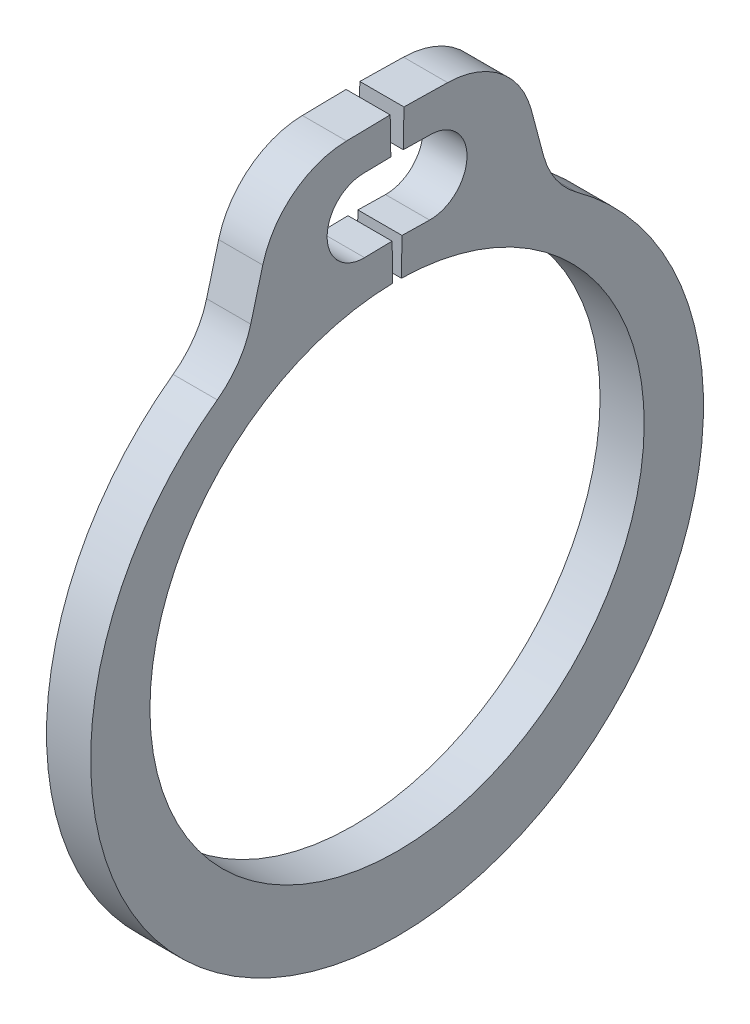
from build123d import *

# Parameters (mm, degrees)
EXTRUDE1_DEPTH = 0.1905
FILLET1_R      = 0.762


with BuildPart() as part:
    # Sketch1 → Extrude1 (new, symmetric)
    with BuildSketch(Plane(origin=(0, 0, 0), x_dir=(0, 0, -1), z_dir=(1, 0, 0))):
        with BuildLine():
            Line((0.059401011, 3.403081615), (1.01175594, 3.386458198))
            Line((1.01175594, 3.386458198), (1.337932753, 2.159059043))
            ThreePointArc((1.337932753, 2.159059043), (0, -2.7686), (-1.337932753, 2.159059043))
            Line((-1.337932753, 2.159059043), (-1.01175594, 3.386458198))
            Line((-1.01175594, 3.386458198), (-0.059401011, 3.403081615))
            Line((-0.059401011, 3.403081615), (-0.053859872, 3.085629972))
            Line((-0.053859872, 3.085629972), (-0.291948604, 3.081474118))
            ThreePointArc((-0.291948604, 3.081474118), (-0.603859108, 2.758481335), (-0.280866326, 2.446570831))
            Line((-0.280866326, 2.446570831), (-0.042777593, 2.450726686))
            Line((-0.042777593, 2.450726686), (-0.037236454, 2.133275042))
            ThreePointArc((-0.037236454, 2.133275042), (0, -2.1336), (0.037236454, 2.133275042))
            Line((0.037236454, 2.133275042), (0.042777593, 2.450726686))
            Line((0.042777593, 2.450726686), (0.280866326, 2.446570831))
            ThreePointArc((0.280866326, 2.446570831), (0.603859108, 2.758481335), (0.291948604, 3.081474118))
            Line((0.291948604, 3.081474118), (0.053859872, 3.085629972))
            Line((0.053859872, 3.085629972), (0.059401011, 3.403081615))
        make_face()
    extrude(amount=EXTRUDE1_DEPTH, both=True)

    # Fillet1
    fillet1_edges = [part.edges().sort_by_distance(p)[0] for p in [
        (0, 3.386458198, -1.01175594),
        (0, 2.159059043, -1.337932753),
        (0, 2.159059043, 1.337932753),
        (0, 3.386458198, 1.01175594),
    ]]
    fillet(fillet1_edges, radius=FILLET1_R)


solid = part.part
